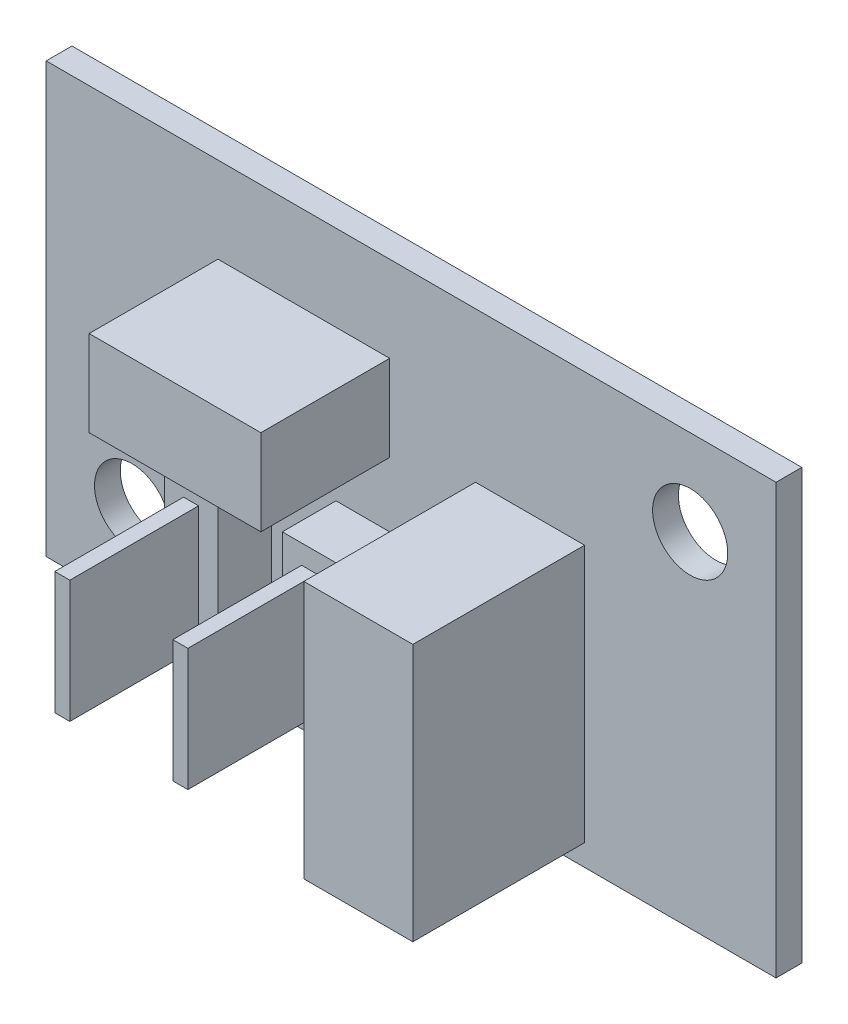
from build123d import *

# Parameters (mm, degrees)
SKETCH1_W           = 34
SKETCH1_H           = 20
BOSS_EXTRUDE1_DEPTH = 0.6
SKETCH2_W           = 2.5
SKETCH2_H           = 7.5
BOSS_EXTRUDE2_DEPTH = 2.5
SKETCH3_W           = 0.7
SKETCH3_H           = 5.7
BOSS_EXTRUDE3_DEPTH = 6
SKETCH4_W           = 0.7
SKETCH4_H           = 5.7
BOSS_EXTRUDE4_DEPTH = 1
SKETCH6_W           = 5.08
SKETCH6_H           = 12
BOSS_EXTRUDE5_DEPTH = 8
SKETCH7_W           = 8
SKETCH7_H           = 4
BOSS_EXTRUDE6_DEPTH = 6
SKETCH8_R           = 1.75
CUT_EXTRUDE1_DEPTH  = 22.476731595


with BuildPart() as part:
    # Sketch1 → Boss-Extrude1 (new, symmetric)
    with BuildSketch(Plane.XY):
        Rectangle(SKETCH1_W, SKETCH1_H)
    extrude(amount=BOSS_EXTRUDE1_DEPTH, both=True)

    # Sketch2 → Boss-Extrude2 (add)
    with BuildSketch(Plane.XY.offset(0.6)):
        with Locations((-7.75, -4.75)):
            Rectangle(SKETCH2_W, SKETCH2_H)
        with Locations((-2.25, -4.75)):
            Rectangle(SKETCH2_W, SKETCH2_H)
    extrude(amount=BOSS_EXTRUDE2_DEPTH)

    # Sketch3 → Boss-Extrude3 (add)
    with BuildSketch(Plane.XY.offset(3.1)):
        with Locations((-7.75, -4.75)):
            Rectangle(SKETCH3_W, SKETCH3_H)
        with Locations((-2.25, -4.75)):
            Rectangle(SKETCH3_W, SKETCH3_H)
    extrude(amount=BOSS_EXTRUDE3_DEPTH)

    # Sketch4 → Boss-Extrude4 (add)
    with BuildSketch(Plane(origin=(0, 0, -0.6), x_dir=(-1, 0, 0), z_dir=(0, 0, -1))):
        with Locations((7.75, -4.75)):
            Rectangle(SKETCH4_W, SKETCH4_H)
        with Locations((2.25, -4.75)):
            Rectangle(SKETCH4_W, SKETCH4_H)
    extrude(amount=BOSS_EXTRUDE4_DEPTH)

    # Sketch6 → Boss-Extrude5 (add)
    with BuildSketch(Plane.XY.offset(0.6)):
        with Locations((5.54, -3)):
            Rectangle(SKETCH6_W, SKETCH6_H)
    extrude(amount=BOSS_EXTRUDE5_DEPTH)

    # Sketch7 → Boss-Extrude6 (add)
    with BuildSketch(Plane.XY.offset(0.6)):
        with Locations((-5, 4)):
            Rectangle(SKETCH7_W, SKETCH7_H)
    extrude(amount=BOSS_EXTRUDE6_DEPTH)

    # Sketch8 → Cut-Extrude1 (cut, through all)
    with BuildSketch(Plane.XY.offset(0.6)):
        with Locations((-13, -6)):
            Circle(SKETCH8_R)
        with Locations((13, 6)):
            Circle(SKETCH8_R)
    extrude(amount=-CUT_EXTRUDE1_DEPTH, mode=Mode.SUBTRACT)


solid = part.part
